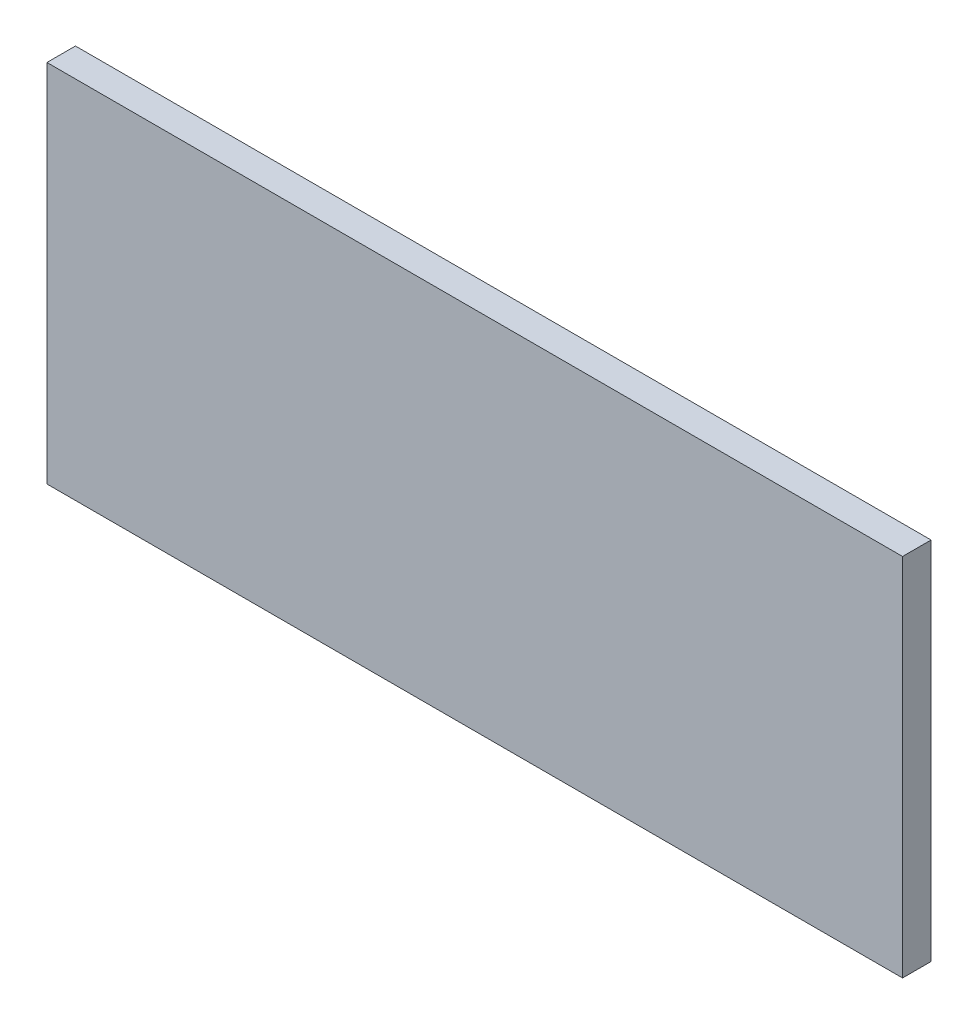
from build123d import *

# Parameters (mm, degrees)
SKETCH1_W           = 150
SKETCH1_H           = 64
BOSS_EXTRUDE1_DEPTH = 5


with BuildPart() as part:
    # Sketch1 → Boss-Extrude1 (new body)
    with BuildSketch(Plane.XY):
        Rectangle(SKETCH1_W, SKETCH1_H)
    extrude(amount=BOSS_EXTRUDE1_DEPTH)


solid = part.part
